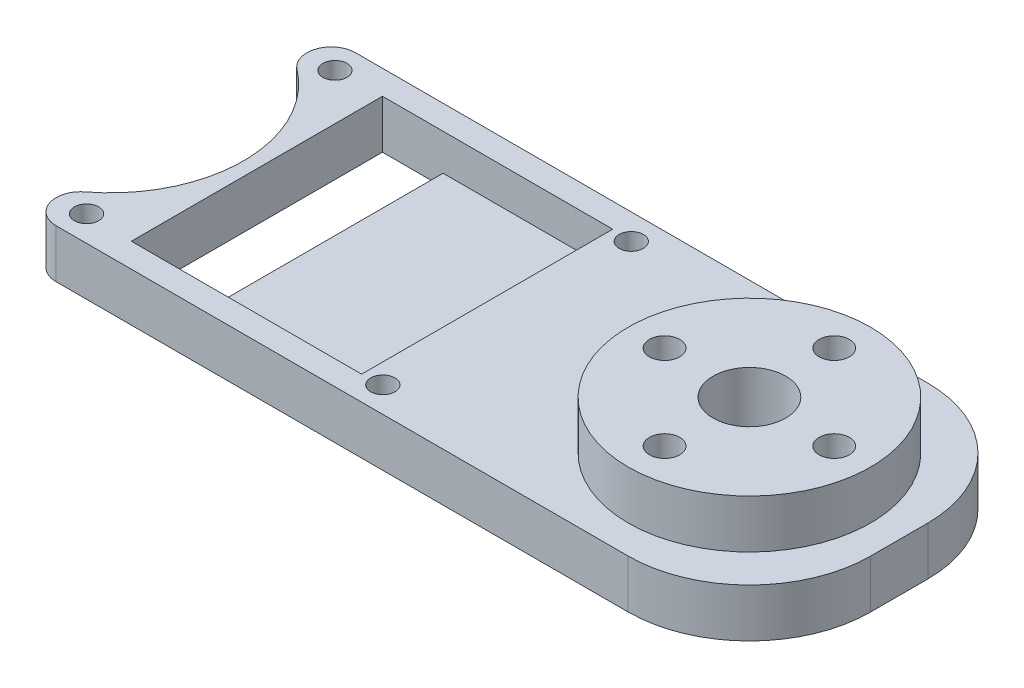
from build123d import *

# Parameters (mm, degrees)
EXTRUDE_1_DEPTH          = 4
CUT_EXTRUDE_1_DEPTH      = 38.905694823
CUT_EXTRUDE_1_DEPTH_BACK = 38.905694823
SKETCH_2_R               = 1
SKETCH_3_W               = 14
SKETCH_3_H               = 20.72
CUT_EXTRUDE_3_DEPTH      = 3
SKETCH_5_W               = 5
SKETCH_5_H               = 20.72
CUT_EXTRUDE_4_DEPTH      = 4
SKETCH_13_W              = 24.72
SKETCH_13_H              = 4
EXTRUDE_5_DEPTH          = 30
SKETCH_15_R              = 10
EXTRUDE_6_DEPTH          = 4
SKETCH_14_R              = 1.25
CUT_EXTRUDE_7_DEPTH      = 4
FILLET_1_R               = 10
FILLET_2_R               = 10
SKETCH_6_R               = 11
CUT_EXTRUDE_9_DEPTH      = 4
SKETCH_17_W              = 24.72
SKETCH_17_H              = 4
CUT_EXTRUDE_10_DEPTH     = 16
FILLET_3_R               = 2
FILLET_4_R               = 2
FILLET_5_R               = 2
FILLET_6_R               = 2
SKETCH_18_R              = 3
CUT_EXTRUDE_11_DEPTH     = 13


with BuildPart() as part:
    # 草图1 → 凸台-拉伸1 (new body)
    with BuildSketch(Plane(origin=(0, 0, 0), x_dir=(1, 0, 0), z_dir=(0, 1, 0))):
        with BuildLine():
            Line((6.61, -12.36), (9.61, -12.36))
            Line((9.61, -12.36), (9.61, -9.36))
            Line((9.61, -9.36), (9.61, 9.36))
            Line((9.61, 9.36), (9.61, 12.36))
            Line((9.61, 12.36), (6.61, 12.36))
            Line((6.61, 12.36), (-32.61, 12.36))
            ThreePointArc((-32.61, 12.36), (-34.731320344, 11.481320344), (-35.61, 9.36))
            Line((-35.61, 9.36), (-35.61, -9.36))
            ThreePointArc((-35.61, -9.36), (-34.731320344, -11.481320344), (-32.61, -12.36))
            Line((-32.61, -12.36), (6.61, -12.36))
        make_face()
    extrude(amount=EXTRUDE_1_DEPTH)

    # 草图2 → 切除-拉伸1 (cut, two sides: drawn at the far end of the back side and taken through both)
    with BuildSketch(Plane(origin=(0, 0, 0), x_dir=(1, 0, 0), z_dir=(0, 1, 0)).offset(-CUT_EXTRUDE_1_DEPTH_BACK)):
        with Locations(Location((7.25, -10.25, 0), (0, 0, 270))):
            Circle(SKETCH_2_R)
        with Locations(Location((7.25, 10.25, 0), (0, 0, 270))):
            Circle(SKETCH_2_R)
        with Locations(Location((-17.2, -10.25, 0), (0, 0, 270))):
            Circle(SKETCH_2_R)
        with Locations(Location((-17.2, 10.25, 0), (0, 0, 270))):
            Circle(SKETCH_2_R)
    extrude(amount=CUT_EXTRUDE_1_DEPTH + CUT_EXTRUDE_1_DEPTH_BACK, mode=Mode.SUBTRACT)

    # 草图3 → 切除-拉伸3 (cut)
    with BuildSketch(Plane(origin=(0, 4, 0), x_dir=(1, 0, 0), z_dir=(0, 1, 0))):
        with Locations((-1.39, 0)):
            Rectangle(SKETCH_3_W, SKETCH_3_H)
    extrude(amount=-CUT_EXTRUDE_3_DEPTH, mode=Mode.SUBTRACT)

    # 草图5 → 切除-拉伸4 (cut)
    with BuildSketch(Plane(origin=(0, 4, 0), x_dir=(1, 0, 0), z_dir=(0, 1, 0))):
        with Locations((-10.89, 0)):
            Rectangle(SKETCH_5_W, SKETCH_5_H)
    extrude(amount=-CUT_EXTRUDE_4_DEPTH, mode=Mode.SUBTRACT)

    # 草图13 → 凸台-拉伸5 (add)
    with BuildSketch(Plane(origin=(9.61, 0, 0), x_dir=(0, 0, -1), z_dir=(1, 0, 0))):
        with Locations((0, 2)):
            Rectangle(SKETCH_13_W, SKETCH_13_H)
    extrude(amount=EXTRUDE_5_DEPTH)

    # 草图15 → 凸台-拉伸6 (add)
    with BuildSketch(Plane(origin=(0, 4, 0), x_dir=(1, 0, 0), z_dir=(0, 1, 0))):
        with Locations(Location((27.25, 0, 0), (0, 0, 270))):
            Circle(SKETCH_15_R)
    extrude(amount=EXTRUDE_6_DEPTH)

    # 草图14 → 切除-拉伸7 (cut, symmetric)
    with BuildSketch(Plane(origin=(0, 4, 0), x_dir=(1, 0, 0), z_dir=(0, 1, 0))):
        with Locations(Location((27.25, -7, 0), (0, 0, 270))):
            Circle(SKETCH_14_R)
        with Locations(Location((34.25, 0, 0), (0, 0, 270))):
            Circle(SKETCH_14_R)
        with Locations(Location((27.25, 7, 0), (0, 0, 270))):
            Circle(SKETCH_14_R)
        with Locations(Location((20.25, 0, 0), (0, 0, 270))):
            Circle(SKETCH_14_R)
    extrude(amount=CUT_EXTRUDE_7_DEPTH, both=True, mode=Mode.SUBTRACT)

    # 圆角1
    fillet_1_edges = [part.edges().sort_by_distance(p)[0] for p in [
        (39.61, 2, -12.36),
    ]]
    fillet(fillet_1_edges, radius=FILLET_1_R)

    # 圆角2
    fillet_2_edges = [part.edges().sort_by_distance(p)[0] for p in [
        (39.61, 2, 12.36),
    ]]
    fillet(fillet_2_edges, radius=FILLET_2_R)

    # 草图6 → 切除-拉伸9 (cut)
    with BuildSketch(Plane(origin=(0, 4, 0), x_dir=(1, 0, 0), z_dir=(0, 1, 0))):
        with Locations((-25.5, 0)):
            Circle(SKETCH_6_R)
    extrude(amount=-CUT_EXTRUDE_9_DEPTH, mode=Mode.SUBTRACT)

    # 草图17 → 切除-拉伸10 (cut)
    with BuildSketch(Plane.ZY.offset(35.61)):
        with Locations((0, 2)):
            Rectangle(SKETCH_17_W, SKETCH_17_H)
    extrude(amount=-CUT_EXTRUDE_10_DEPTH, mode=Mode.SUBTRACT)

    # 圆角3
    fillet_3_edges = [part.edges().sort_by_distance(p)[0] for p in [
        (-19.61, 2, 12.36),
    ]]
    fillet(fillet_3_edges, radius=FILLET_3_R)

    # 圆角4
    fillet_4_edges = [part.edges().sort_by_distance(p)[0] for p in [
        (-19.61, 2, -12.36),
    ]]
    fillet(fillet_4_edges, radius=FILLET_4_R)

    # 圆角5
    fillet_5_edges = [part.edges().sort_by_distance(p)[0] for p in [
        (-19.61, 2, -9.290204519),
    ]]
    fillet(fillet_5_edges, radius=FILLET_5_R)

    # 圆角6
    fillet_6_edges = [part.edges().sort_by_distance(p)[0] for p in [
        (-19.61, 2, 9.290204519),
    ]]
    fillet(fillet_6_edges, radius=FILLET_6_R)

    # 草图18 → 切除-拉伸11 (cut)
    with BuildSketch(Plane(origin=(0, 8, 0), x_dir=(1, 0, 0), z_dir=(0, 1, 0))):
        with Locations(Location((27.25, 0, 0), (0, 0, 270))):
            Circle(SKETCH_18_R)
    extrude(amount=-CUT_EXTRUDE_11_DEPTH, mode=Mode.SUBTRACT)


solid = part.part
